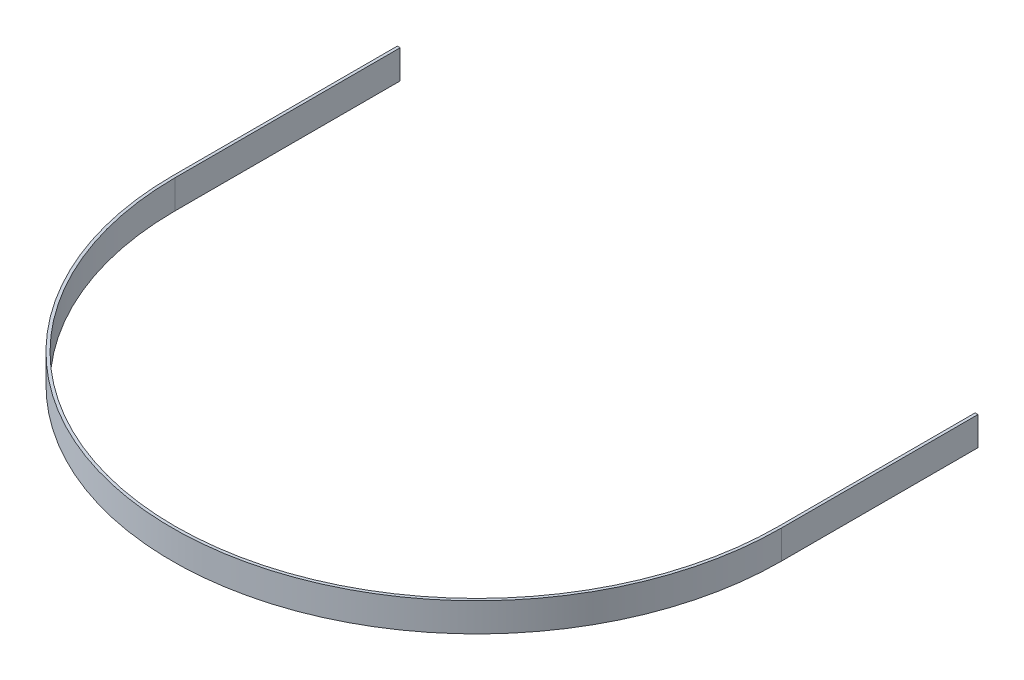
from build123d import *

# Parameters (mm, degrees)
BOSS_EXTRUDE1_DEPTH = 3


with BuildPart() as part:
    # Sketch1 → Boss-Extrude1 (new body)
    with BuildSketch(Plane(origin=(0, 0, 0), x_dir=(1, 0, 0), z_dir=(0, 1, 0))):
        with BuildLine():
            Line((-31.5, 0), (-31.5, -23.5))
            ThreePointArc((-31.5, -23.5), (0, -55), (31.5, -23.5))
            Line((31.5, -23.5), (31.5, -3))
            Line((31.5, -3), (31.8, -3))
            Line((31.8, -3), (31.8, -23.5))
            ThreePointArc((31.8, -23.5), (0, -55.3), (-31.8, -23.5))
            Line((-31.8, -23.5), (-31.8, 0))
            Line((-31.8, 0), (-31.5, 0))
        make_face()
    extrude(amount=BOSS_EXTRUDE1_DEPTH)


solid = part.part
